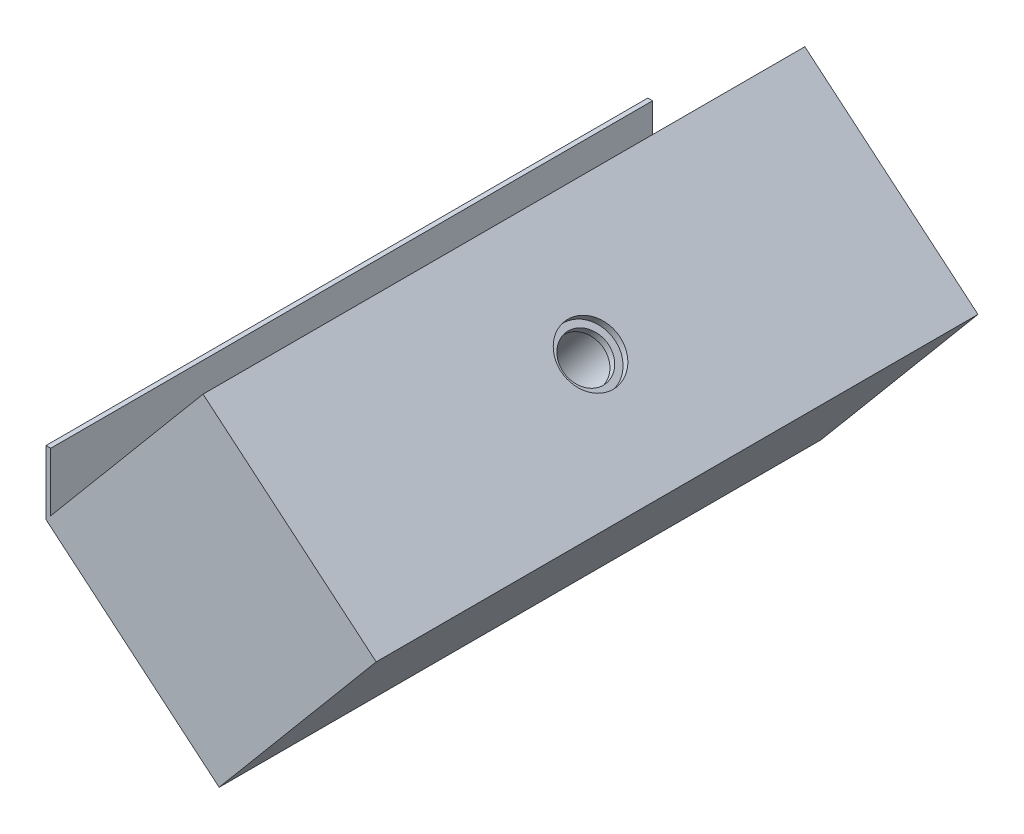
from build123d import *

# Parameters (mm, degrees)
BOSS_EXTRUDE1_DEPTH     = 262.8
CUT_EXTRUDE3_DEPTH      = 560.510929996
CUT_EXTRUDE3_DEPTH_BACK = 560.510929996
SKETCH6_R               = 36
BOSS_EXTRUDE4_DEPTH     = 275
BOSS_EXTRUDE5_DEPTH     = 275
SKETCH11_W              = 305.28
SKETCH11_H              = 812.8
SKETCH11_R              = 31
BOSS_EXTRUDE6_DEPTH     = 10
SKETCH12_W              = 305.28
SKETCH12_H              = 812.8
SKETCH12_R              = 40
BOSS_EXTRUDE7_DEPTH     = 10
SKETCH13_R              = 20.52
CUT_EXTRUDE4_DEPTH      = 170


with BuildPart() as part:
    # Sketch1 → Boss-Extrude1 (new body)
    with BuildSketch(Plane.XY):
        Polygon((0, 0), (0, 86.668071476), (6.393546256, 86.668071476), (6.393546256, 7.619531721), (199.264159003, 237.473777367), (433.122206598, 41.243575882), (233.858047595, -196.230201485), align=None)
    extrude(amount=BOSS_EXTRUDE1_DEPTH)

    # Sketch6 → Cut-Extrude3 (cut, two sides: drawn at the far end of the back side and taken through both)
    with BuildSketch(Plane(origin=(0, 0, 0), x_dir=(-0.7660444431189771, 0.6427876096865406, 0), z_dir=(-0.6427876096865405, -0.766044443118977, 0)).offset(-CUT_EXTRUDE3_DEPTH_BACK)):
        with Locations((-152.64, -131.4)):
            Circle(SKETCH6_R)
    extrude(amount=CUT_EXTRUDE3_DEPTH + CUT_EXTRUDE3_DEPTH_BACK, mode=Mode.SUBTRACT)

    # Sketch7 → Boss-Extrude4 (add)
    with BuildSketch(Plane.XY.offset(262.8)):
        Polygon((233.858047595, -196.230201485), (0, 0), (0, 86.668071476), (6.393546256, 86.668071476), (6.393546256, 7.619531721), (199.264159003, 237.473777367), (433.122206598, 41.243575882), align=None)
    extrude(amount=BOSS_EXTRUDE4_DEPTH)

    # Sketch8 → Boss-Extrude5 (add)
    with BuildSketch(Plane(origin=(0, 0, 0), x_dir=(-1, 0, 0), z_dir=(0, 0, -1))):
        Polygon((0, 0), (0, 86.668071476), (-6.393546256, 86.668071476), (-6.393546256, 7.619531721), (-199.264159003, 237.473777367), (-433.122206598, 41.243575882), (-233.858047595, -196.230201485), align=None)
    extrude(amount=BOSS_EXTRUDE5_DEPTH)

    # Sketch11 → Boss-Extrude6 (add)
    with BuildSketch(Plane(origin=(199.264159003, 237.473777367, 0), x_dir=(0.7660444431189771, -0.6427876096865404, 0), z_dir=(0.6427876096865404, 0.7660444431189771, 0))):
        with Locations((152.64, -131.4)):
            Rectangle(SKETCH11_W, SKETCH11_H)
        with Locations(Location((152.64, -131.4, 0), (0, 0, 180))):
            Circle(SKETCH11_R, mode=Mode.SUBTRACT)
    extrude(amount=BOSS_EXTRUDE6_DEPTH)

    # Sketch12 → Boss-Extrude7 (add)
    with BuildSketch(Plane(origin=(205.6920351, 245.134221798, 0), x_dir=(0.7660444431189771, -0.6427876096865406, 0), z_dir=(0.6427876096865405, 0.766044443118977, 0))):
        with Locations((152.64, -131.4)):
            Rectangle(SKETCH12_W, SKETCH12_H)
        with Locations((152.64, -131.4)):
            Circle(SKETCH12_R, mode=Mode.SUBTRACT)
    extrude(amount=BOSS_EXTRUDE7_DEPTH)

    # Sketch13 → Cut-Extrude4 (cut)
    with BuildSketch(Plane(origin=(0, 0, 0), x_dir=(-0.7660444431189771, 0.6427876096865406, 0), z_dir=(-0.6427876096865405, -0.766044443118977, 0))):
        with Locations(Location((-57.599898279, -131.291749379, 0), (0, 0, 180))):
            Circle(SKETCH13_R)
        with Locations(Location((-247.507544032, -131.291749379, 0), (0, 0, 180))):
            Circle(SKETCH13_R)
    extrude(amount=-CUT_EXTRUDE4_DEPTH, mode=Mode.SUBTRACT)


solid = part.part
